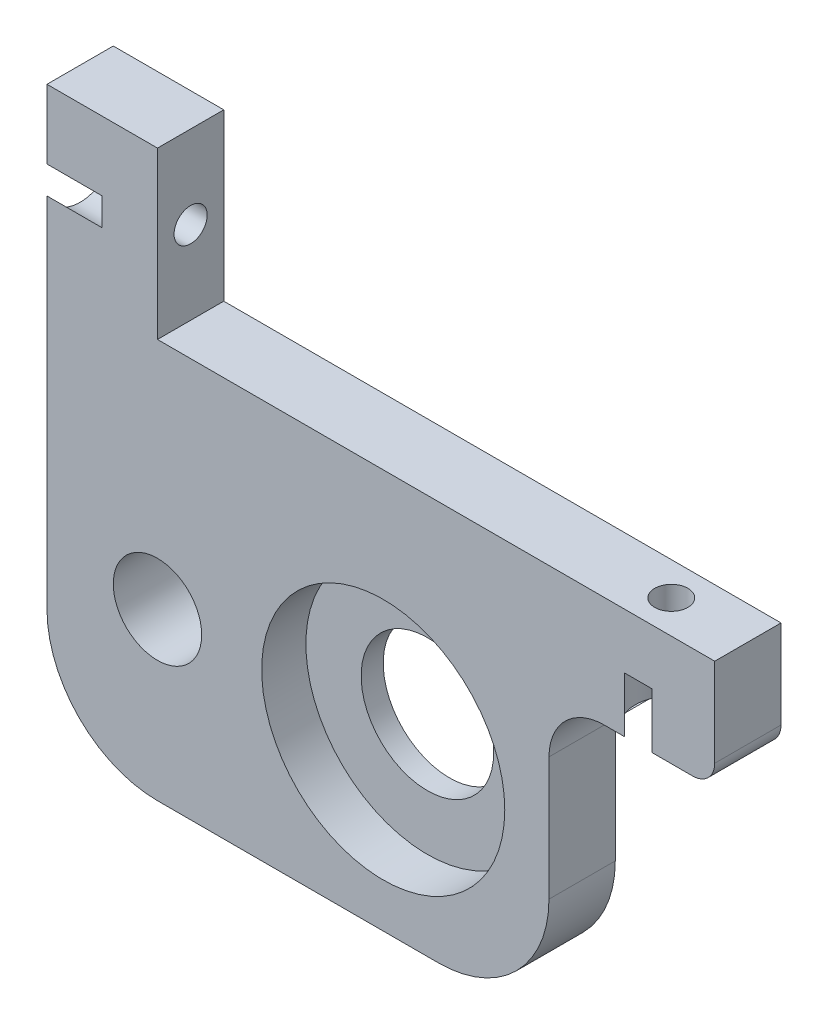
from build123d import *

# Parameters (mm, degrees)
CROQUIS1_R              = 4
CROQUIS1_R_2            = 6
SALIENTE_EXTRUIR2_DEPTH = 6
CROQUIS2_R              = 11
CORTAR_EXTRUIR1_DEPTH   = 4
CROQUIS3_R              = 1.5
CORTAR_EXTRUIR2_DEPTH   = 71.672536391
CROQUIS4_R              = 1.5
CORTAR_EXTRUIR3_DEPTH   = 63.337848856
CROQUIS5_R              = 3.25
CORTAR_EXTRUIR4_DEPTH   = 5
CROQUIS6_R              = 3.25
CORTAR_EXTRUIR5_DEPTH   = 5


with BuildPart() as part:
    # Croquis1 → Saliente-Extruir2 (new body)
    with BuildSketch(Plane.XY):
        with BuildLine():
            Line((-50.43, 0), (0, 0))
            Line((0, 0), (0, -8))
            ThreePointArc((0, -8), (-0.585786438, -9.414213562), (-2, -10))
            Line((-2, -10), (-10, -10))
            ThreePointArc((-10, -10), (-13.535533906, -11.464466094), (-15, -15))
            Line((-15, -15), (-15, -26.15))
            ThreePointArc((-15, -26.15), (-17.928932188, -33.221067812), (-25, -36.15))
            Line((-25, -36.15), (-50.43, -36.15))
            ThreePointArc((-50.43, -36.15), (-57.501067812, -33.221067812), (-60.43, -26.15))
            Line((-60.43, -26.15), (-60.43, 15))
            Line((-60.43, 15), (-50.43, 15))
            Line((-50.43, 15), (-50.43, 0))
        make_face()
        with Locations((-50.43, -21.15)):
            Circle(CROQUIS1_R, mode=Mode.SUBTRACT)
        with Locations((-30, -21.15)):
            Circle(CROQUIS1_R_2, mode=Mode.SUBTRACT)
    extrude(amount=SALIENTE_EXTRUIR2_DEPTH)

    # Croquis2 → Cortar-Extruir1 (cut)
    with BuildSketch(Plane.XY.offset(6)):
        with Locations((-30, -21.15)):
            Circle(CROQUIS2_R)
    extrude(amount=-CORTAR_EXTRUIR1_DEPTH, mode=Mode.SUBTRACT)

    # Croquis3 → Cortar-Extruir2 (cut, through all)
    with BuildSketch(Plane(origin=(0, 0, 0), x_dir=(-1, 0, 0), z_dir=(0, 1, 0))):
        with Locations(Location((6.93, 3, 0), (0, 0, 90))):
            Circle(CROQUIS3_R)
    extrude(amount=-CORTAR_EXTRUIR2_DEPTH, mode=Mode.SUBTRACT)

    # Croquis4 → Cortar-Extruir3 (cut, through all)
    with BuildSketch(Plane(origin=(-50.43, 0, 0), x_dir=(0, 0, -1), z_dir=(1, 0, 0))):
        with Locations((-3, 7.5)):
            Circle(CROQUIS4_R)
    extrude(amount=-CORTAR_EXTRUIR3_DEPTH, mode=Mode.SUBTRACT)

    # Croquis5 → Cortar-Extruir4 (cut)
    with BuildSketch(Plane.ZY.offset(60.43)):
        with Locations((3, 7.5)):
            Circle(CROQUIS5_R)
    extrude(amount=-CORTAR_EXTRUIR4_DEPTH, mode=Mode.SUBTRACT)

    # Croquis6 → Cortar-Extruir5 (cut)
    with BuildSketch(Plane.XZ.offset(10)):
        with Locations((-6.93, 3)):
            Circle(CROQUIS6_R)
    extrude(amount=-CORTAR_EXTRUIR5_DEPTH, mode=Mode.SUBTRACT)


solid = part.part
